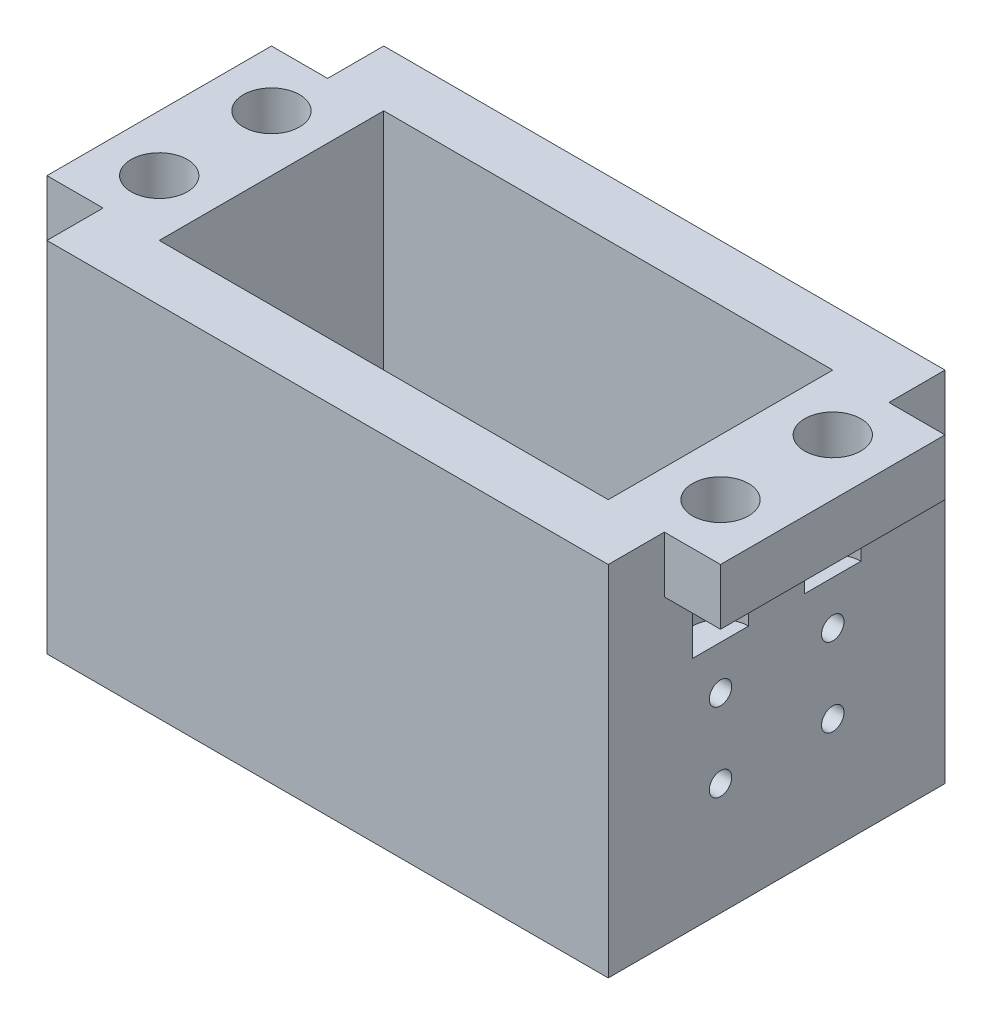
from build123d import *

# Parameters (mm, degrees)
SKETCH1_W           = 50
SKETCH1_H           = 30
SKETCH1_W_2         = 40
SKETCH1_H_2         = 20
BOSS_EXTRUDE1_DEPTH = 26.9
SKETCH2_W           = 10
SKETCH2_H           = 20
SKETCH2_R           = 2.5
BOSS_EXTRUDE2_DEPTH = 5
SKETCH3_R           = 2.5
CUT_EXTRUDE1_DEPTH  = 11
SKETCH5_R           = 1.5
CUT_EXTRUDE3_DEPTH  = 3
SKETCH6_R           = 1
CUT_EXTRUDE4_DEPTH  = 9
SKETCH7_W           = 50
SKETCH7_H           = 30
BOSS_EXTRUDE3_DEPTH = 5


with BuildPart() as part:
    # Sketch1 → Boss-Extrude1 (new body)
    with BuildSketch(Plane(origin=(0, 0, 0), x_dir=(1, 0, 0), z_dir=(0, 1, 0))):
        Rectangle(SKETCH1_W, SKETCH1_H)
        Rectangle(SKETCH1_W_2, SKETCH1_H_2, mode=Mode.SUBTRACT)
    extrude(amount=BOSS_EXTRUDE1_DEPTH)

    # Sketch2 → Boss-Extrude2 (add)
    # profile 1 of 2: a face of its own
    with BuildSketch(Plane(origin=(0, 26.9, 0), x_dir=(1, 0, 0), z_dir=(0, 1, 0))):
        with Locations((25, 0)):
            Rectangle(SKETCH2_W, SKETCH2_H)
        with Locations((25, 5)):
            Circle(SKETCH2_R, mode=Mode.SUBTRACT)
        with Locations((25, -5)):
            Circle(SKETCH2_R, mode=Mode.SUBTRACT)
    # profile 2 of 2: a face of its own
    with BuildSketch(Plane(origin=(0, 26.9, 0), x_dir=(1, 0, 0), z_dir=(0, 1, 0))):
        with Locations((-25, 0)):
            Rectangle(SKETCH2_W, SKETCH2_H)
        with Locations((-25, -5)):
            Circle(SKETCH2_R, mode=Mode.SUBTRACT)
        with Locations((-25, 5)):
            Circle(SKETCH2_R, mode=Mode.SUBTRACT)
    extrude(amount=-BOSS_EXTRUDE2_DEPTH)

    # Sketch3 → Cut-Extrude1 (cut)
    with BuildSketch(Plane(origin=(0, 26.9, 0), x_dir=(1, 0, 0), z_dir=(0, 1, 0))):
        with Locations(Location((-25, 5, 0), (0, 0, 90))):
            Circle(SKETCH3_R)
        with Locations(Location((-25, -5, 0), (0, 0, 90))):
            Circle(SKETCH3_R)
        with Locations(Location((25, -5, 0), (0, 0, 270))):
            Circle(SKETCH3_R)
        with Locations(Location((25, 5, 0), (0, 0, 270))):
            Circle(SKETCH3_R)
    extrude(amount=-CUT_EXTRUDE1_DEPTH, mode=Mode.SUBTRACT)

    # Sketch5 → Cut-Extrude3 (cut)
    with BuildSketch(Plane.ZY.offset(-20)):
        with Locations((-5, 12)):
            Circle(SKETCH5_R)
        with Locations((-5, 5)):
            Circle(SKETCH5_R)
        with Locations((5, 12)):
            Circle(SKETCH5_R)
        with Locations((5, 5)):
            Circle(SKETCH5_R)
    extrude(amount=-CUT_EXTRUDE3_DEPTH, mode=Mode.SUBTRACT)

    # Sketch6 → Cut-Extrude4 (cut)
    with BuildSketch(Plane.ZY.offset(-23)):
        with Locations((-5, 12)):
            Circle(SKETCH6_R)
        with Locations((5, 12)):
            Circle(SKETCH6_R)
        with Locations((-5, 5)):
            Circle(SKETCH6_R)
        with Locations((5, 5)):
            Circle(SKETCH6_R)
    extrude(amount=-CUT_EXTRUDE4_DEPTH, mode=Mode.SUBTRACT)

    # Sketch7 → Boss-Extrude3 (add)
    with BuildSketch(Plane.XZ):
        Rectangle(SKETCH7_W, SKETCH7_H)
    extrude(amount=BOSS_EXTRUDE3_DEPTH)


solid = part.part
